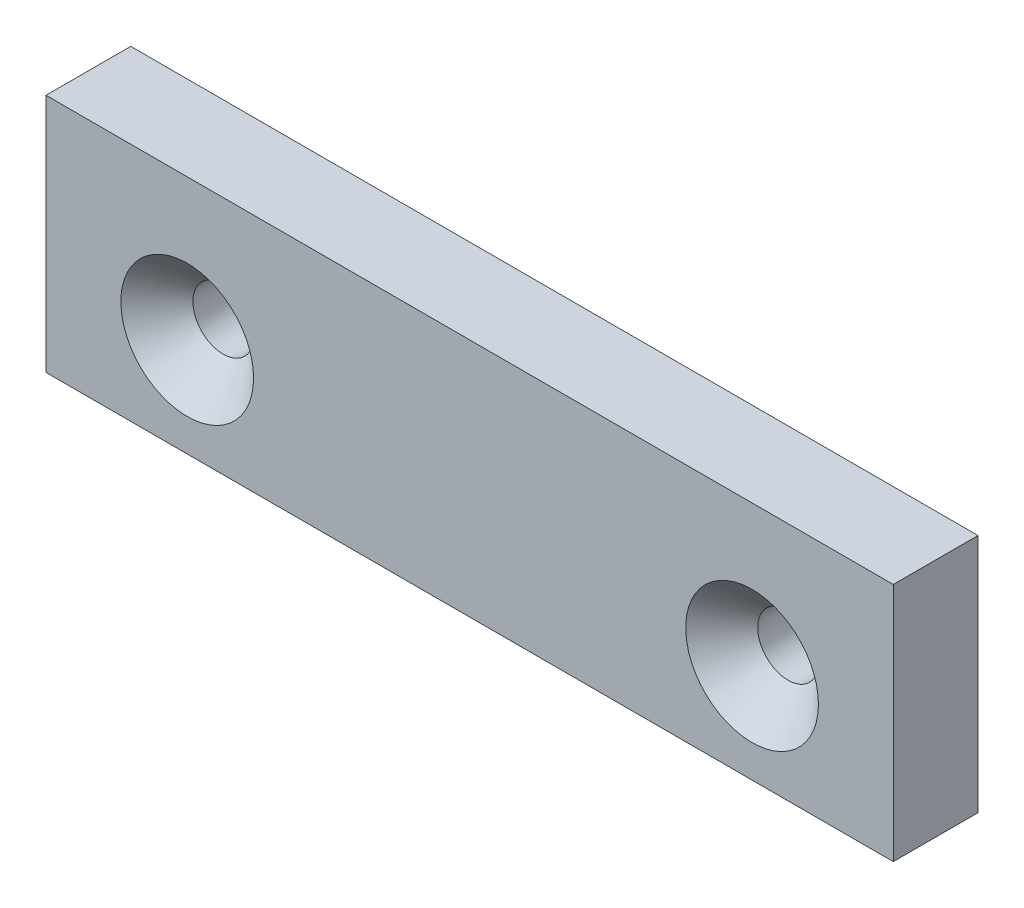
from build123d import *

# Parameters (mm, degrees)
SKETCH1_W                                       = 60
SKETCH1_H                                       = 17
BOSS_EXTRUDE1_DEPTH                             = 6
CSK_FOR_M4_FLAT_HEAD_MACHINE_SCREW1_D           = 4.3
CSK_FOR_M4_FLAT_HEAD_MACHINE_SCREW1_CSINK_D     = 9.4
CSK_FOR_M4_FLAT_HEAD_MACHINE_SCREW1_CSINK_ANGLE = 90


with BuildPart() as part:
    # Sketch1 → Boss-Extrude1 (new body)
    with BuildSketch(Plane.XY):
        with Locations((30, 8.5)):
            Rectangle(SKETCH1_W, SKETCH1_H)
    extrude(amount=BOSS_EXTRUDE1_DEPTH)

    # CSK for M4 Flat Head Machine Screw1 (through all)
    with Locations(Plane.XY.offset(6)):
        with Locations((10, 7), (50, 7)):
            CounterSinkHole(CSK_FOR_M4_FLAT_HEAD_MACHINE_SCREW1_D / 2, CSK_FOR_M4_FLAT_HEAD_MACHINE_SCREW1_CSINK_D / 2, counter_sink_angle=CSK_FOR_M4_FLAT_HEAD_MACHINE_SCREW1_CSINK_ANGLE)


solid = part.part
